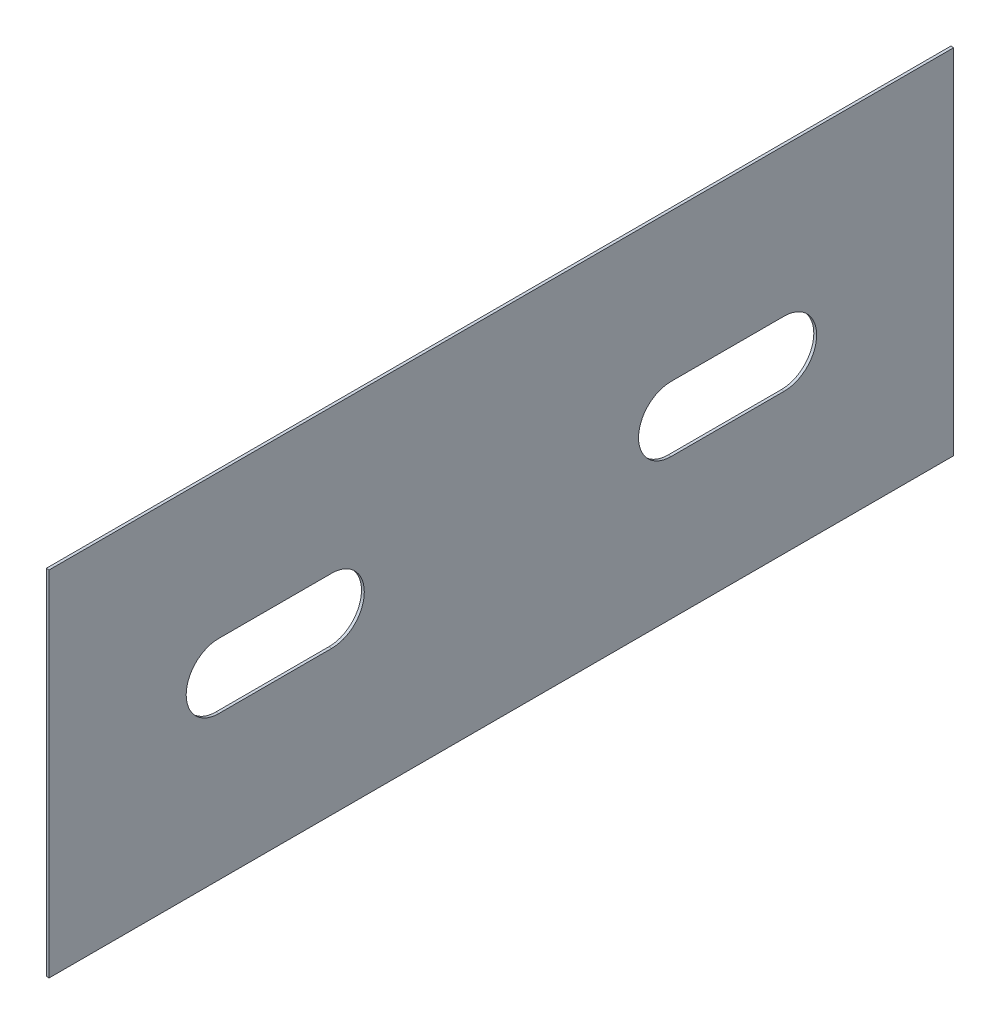
from build123d import *

# Parameters (mm, degrees)
SKETCH1_W           = 640
SKETCH1_H           = 250
BOSS_EXTRUDE1_DEPTH = 2


with BuildPart() as part:
    # Sketch1 → Boss-Extrude1 (new body)
    with BuildSketch(Plane(origin=(0, 0, 0), x_dir=(0, 0, -1), z_dir=(1, 0, 0))):
        with Locations((1.245136187, 10.719844358)):
            Rectangle(SKETCH1_W, SKETCH1_H)
        with BuildLine():
            Line((-198.754863813, 33.719844358), (-118.754863813, 33.719844358))
            ThreePointArc((-118.754863813, 33.719844358), (-95.754863813, 10.719844358), (-118.754863813, -12.280155642))
            Line((-118.754863813, -12.280155642), (-198.754863813, -12.280155642))
            ThreePointArc((-198.754863813, -12.280155642), (-221.754863813, 10.719844358), (-198.754863813, 33.719844358))
        make_face(mode=Mode.SUBTRACT)
        with BuildLine():
            Line((121.245136187, 31.192184468), (201.245136187, 31.192184468))
            ThreePointArc((201.245136187, 31.192184468), (224.245136187, 8.192184468), (201.245136187, -14.807815532))
            Line((201.245136187, -14.807815532), (121.245136187, -14.807815532))
            ThreePointArc((121.245136187, -14.807815532), (98.245136187, 8.192184468), (121.245136187, 31.192184468))
        make_face(mode=Mode.SUBTRACT)
    extrude(amount=BOSS_EXTRUDE1_DEPTH)


solid = part.part
